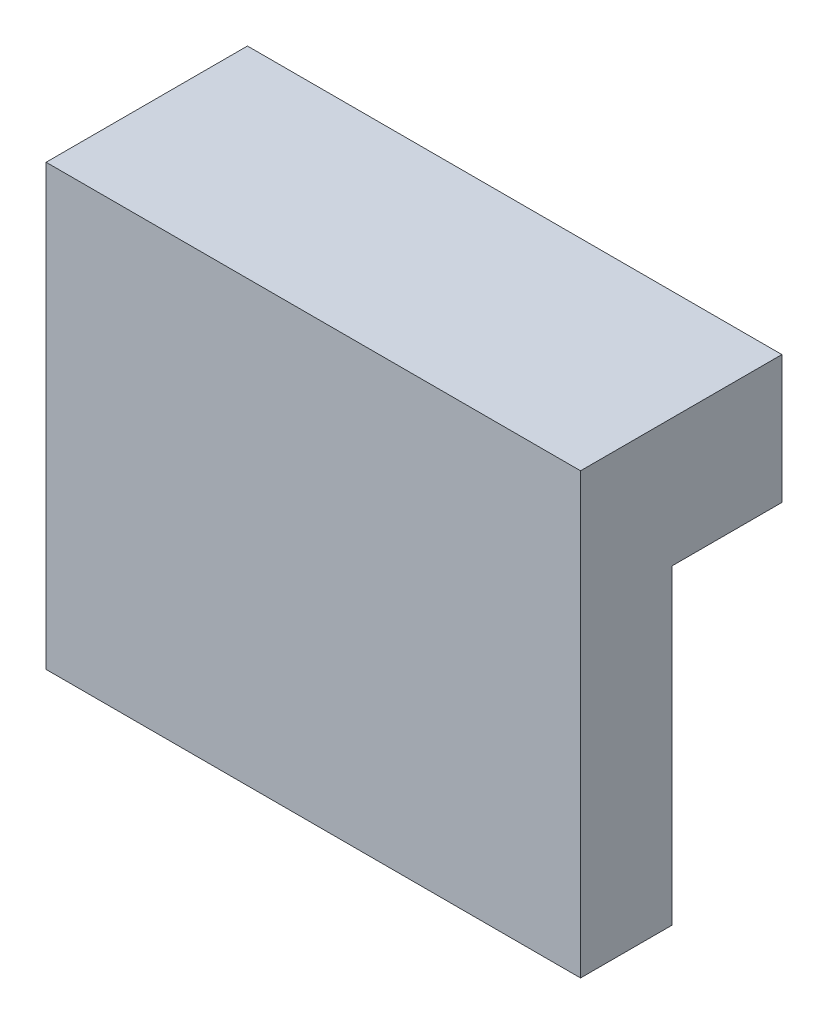
from build123d import *

# Parameters (mm, degrees)
SKETCH_1_W      = 146
SKETCH_1_H      = 120
EXTRUDE_1_DEPTH = 12.5
SKETCH_2_W      = 146
SKETCH_2_H      = 35
EXTRUDE_2_DEPTH = 30


with BuildPart() as part:
    # 草图1 → 凸台-拉伸1 (new, symmetric)
    with BuildSketch(Plane.XY):
        Rectangle(SKETCH_1_W, SKETCH_1_H)
    extrude(amount=EXTRUDE_1_DEPTH, both=True)

    # 草图2 → 凸台-拉伸2 (add)
    with BuildSketch(Plane(origin=(0, 0, -12.5), x_dir=(-1, 0, 0), z_dir=(0, 0, -1))):
        with Locations((0, 42.5)):
            Rectangle(SKETCH_2_W, SKETCH_2_H)
    extrude(amount=EXTRUDE_2_DEPTH)


solid = part.part
